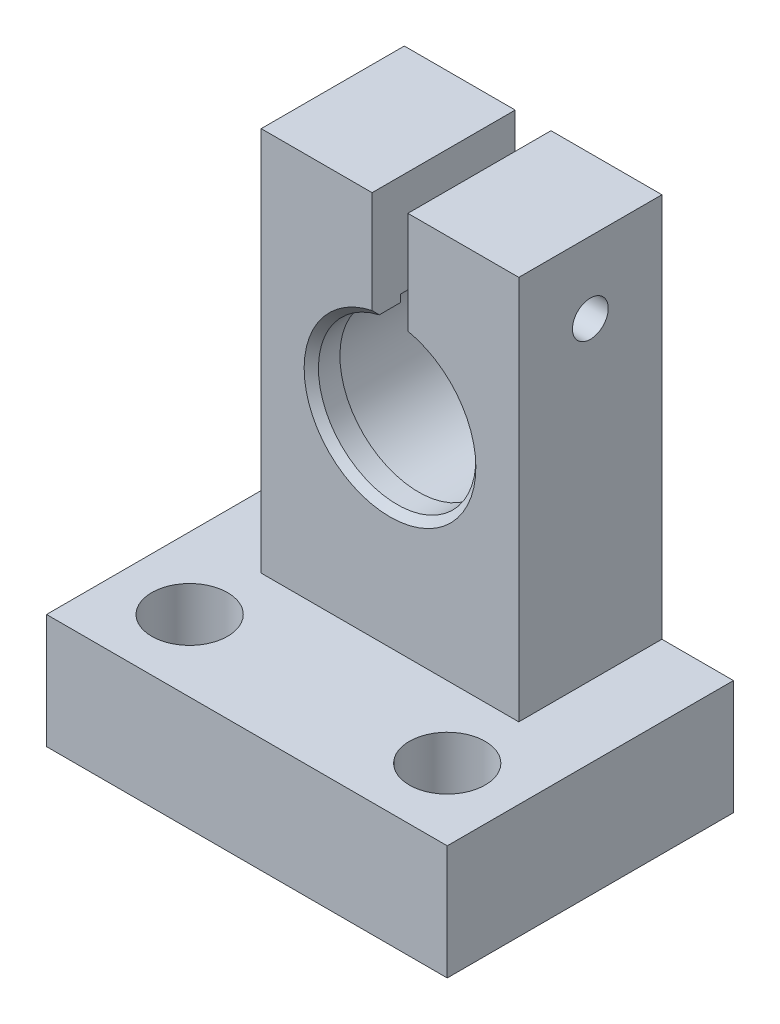
from build123d import *

# Parameters (mm, degrees)
SKETCH1_W                      = 18
SKETCH1_H                      = 34.9
SKETCH1_R                      = 6
BOSS_EXTRUDE1_DEPTH            = 10
BOSS_EXTRUDE2_START            = 2
SKETCH2_R                      = 6
SKETCH2_R_2                    = 5.5
BOSS_EXTRUDE2_DEPTH            = 2
SKETCH3_W                      = 2.5
SKETCH3_H                      = 7.643928679
CUT_EXTRUDE1_DEPTH             = 26.702334524
CBORE_FOR_M3_SHCS1_D           = 3.2
CBORE_FOR_M3_SHCS1_DEPTH       = 7.75
CBORE_FOR_M3_SHCS1_CBORE_D     = 6.5
CBORE_FOR_M3_SHCS1_CBORE_DEPTH = 3
TAP_DRILL_FOR_M3X0_5_TAP1_D    = 2.5
CHAMFER1_SIZE                  = 0.5
SKETCH11_W                     = 10
SKETCH11_H                     = 8
BOSS_EXTRUDE4_DEPTH            = 5
SKETCH8_W                      = 28
SKETCH8_H                      = 10
BOSS_EXTRUDE3_DEPTH            = 8
M5_CLEARANCE_HOLE1_D           = 5.3


with BuildPart() as part:
    # Sketch1 → Boss-Extrude1 (new body)
    with BuildSketch(Plane.XY):
        with Locations((0, -4.45)):
            Rectangle(SKETCH1_W, SKETCH1_H)
        Circle(SKETCH1_R, mode=Mode.SUBTRACT)
    extrude(amount=BOSS_EXTRUDE1_DEPTH)

    # Sketch2 → Boss-Extrude2 (add)
    with BuildSketch(Plane(origin=(0, 0, 10), x_dir=(-1, 0, 0), z_dir=(0, 0, -1)).offset(BOSS_EXTRUDE2_START)):
        Circle(SKETCH2_R)
        Circle(SKETCH2_R_2, mode=Mode.SUBTRACT)
    extrude(amount=-BOSS_EXTRUDE2_DEPTH)

    # Sketch3 → Cut-Extrude1 (cut, through all)
    with BuildSketch(Plane.XY.offset(10)):
        with Locations((0, 9.178035661)):
            Rectangle(SKETCH3_W, SKETCH3_H)
    extrude(amount=-CUT_EXTRUDE1_DEPTH, mode=Mode.SUBTRACT)

    # CBORE for M3 SHCS1
    with Locations(Plane(origin=(9, 0, 0), x_dir=(0, 0, -1), z_dir=(1, 0, 0))):
        with Locations((-5, 8)):
            CounterBoreHole(CBORE_FOR_M3_SHCS1_D / 2, CBORE_FOR_M3_SHCS1_CBORE_D / 2, CBORE_FOR_M3_SHCS1_CBORE_DEPTH, depth=CBORE_FOR_M3_SHCS1_DEPTH)

    # Tap Drill for M3x0.5 Tap1 (through all)
    with Locations(Plane.ZY.offset(9)):
        with Locations((5, 8)):
            Hole(TAP_DRILL_FOR_M3X0_5_TAP1_D / 2)

    # Chamfer1
    chamfer1_edges = [part.edges().sort_by_distance(p)[0] for p in [
        (0, -5.5, 10),
        (0, -6, 0),
    ]]
    chamfer(chamfer1_edges, length=CHAMFER1_SIZE)

    # Sketch11 → Boss-Extrude4 (add)
    with BuildSketch(Plane.ZY.offset(9)):
        with Locations((5, -17.9)):
            Rectangle(SKETCH11_W, SKETCH11_H)
    boss_extrude4 = extrude(amount=BOSS_EXTRUDE4_DEPTH)

    # Mirror1: Boss-Extrude4 across plane
    add(boss_extrude4.mirror(Plane(origin=(0, 0, 0), x_dir=(0, 0, 1), z_dir=(1, 0, 0))))

    # Sketch8 → Boss-Extrude3 (add)
    with BuildSketch(Plane.XZ.offset(21.9)):
        with Locations((0, 15)):
            Rectangle(SKETCH8_W, SKETCH8_H)
    extrude(amount=-BOSS_EXTRUDE3_DEPTH)

    # M5 Clearance Hole1 (through all)
    with Locations(Plane(origin=(0, -13.9, 0), x_dir=(1, 0, 0), z_dir=(0, 1, 0))):
        with Locations((-9, -15), (9, -15)):
            Hole(M5_CLEARANCE_HOLE1_D / 2)


with BuildPart() as body_2:
    # Mirror2: mirrored copy
    add(part.part.mirror(Plane.ZY.offset(-14)))


solid = body_2.part
